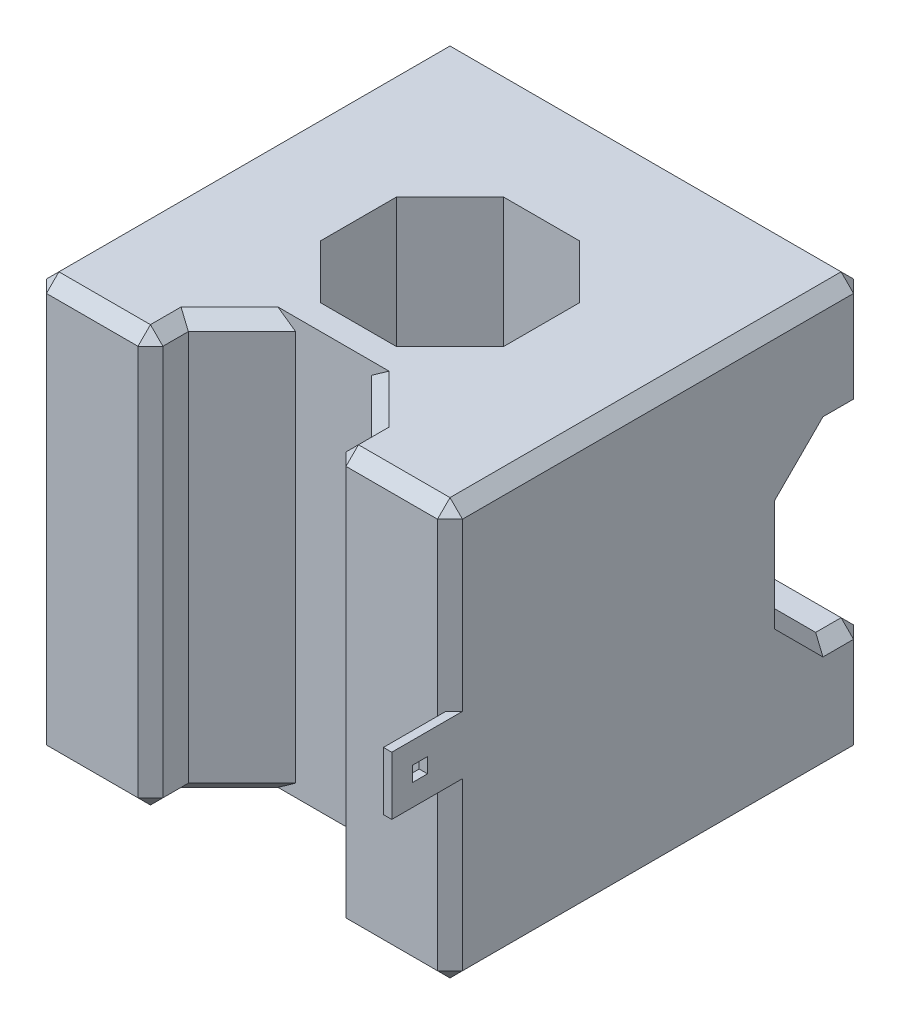
from build123d import *

# Parameters (mm, degrees)
SKETCH1_W                = 50
SKETCH1_H                = 50
BOSS_EXTRUDE1_DEPTH      = 50
CUT_EXTRUDE2_DEPTH       = 87.602540378
CUT_EXTRUDE3_DEPTH       = 87.602540378
CHAMFER1_SIZE            = 1.5
BOSS_EXTRUDE2_DEPTH      = 7
BOSS_EXTRUDE2_DEPTH_BACK = 10
SKETCH5_W                = 1
SKETCH5_H                = 7
SKETCH6_W                = 1.8
SKETCH6_H                = 1.8
CUT_EXTRUDE4_DEPTH       = 7


with BuildPart() as part:
    # Sketch1 → Boss-Extrude1 (new body)
    with BuildSketch(Plane.XY):
        with Locations((25, 25)):
            Rectangle(SKETCH1_W, SKETCH1_H)
    extrude(amount=BOSS_EXTRUDE1_DEPTH)

    # Sketch3 → Cut-Extrude2 (cut, through all)
    with BuildSketch(Plane.XZ):
        Polygon((29.556349186, 36), (20.443650814, 36), (14, 29.556349186), (14, 20.443650814), (20.443650814, 14), (29.556349186, 14), (36, 20.443650814), (36, 29.556349186), align=None)
        Polygon((29.556349186, 39), (36, 45.443650814), (36, 54.556349186), (29.556349186, 61), (20.443650814, 61), (14, 54.556349186), (14, 45.443650814), (20.443650814, 39), align=None)
    extrude(amount=-CUT_EXTRUDE2_DEPTH, mode=Mode.SUBTRACT)

    # Sketch4 → Cut-Extrude3 (cut, through all)
    with BuildSketch(Plane.ZY):
        Polygon((4.556349186, 14), (11, 20.443650814), (11, 29.556349186), (4.556349186, 36), (-4.556349186, 36), (-11, 29.556349186), (-11, 20.443650814), (-4.556349186, 14), align=None)
    extrude(amount=-CUT_EXTRUDE3_DEPTH, mode=Mode.SUBTRACT)

    # Chamfer1
    chamfer1_edges = [part.edges().sort_by_distance(p)[0] for p in [
        (50, 25, 50),
        (43, 50, 50),
        (43, 0, 50),
        (7, 50, 50),
        (36, 25, 50),
        (14, 25, 50),
        (0, 25, 50),
        (14, 50, 47.721825407),
        (36, 50, 47.721825407),
        (25, 50, 0),
        (36, 0, 47.721825407),
        (14, 0, 47.721825407),
        (17.221825407, 0, 42.221825407),
        (32.778174593, 0, 42.221825407),
        (17.221825407, 50, 42.221825407),
        (50, 7, 0),
        (32.778174593, 50, 42.221825407),
        (25, 0, 0),
        (0, 43, 0),
        (7, 0, 50),
        (0, 50, 25),
        (50, 50, 25),
        (50, 0, 25),
        (0, 0, 25),
        (0, 7, 0),
        (50, 43, 0),
        (25, 36, 0),
        (25, 14, 0),
        (50, 14, 2.278174593),
        (50, 36, 2.278174593),
        (50, 32.778174593, 7.778174593),
        (50, 17.221825407, 7.778174593),
        (0, 14, 2.278174593),
        (0, 17.221825407, 7.778174593),
        (0, 32.778174593, 7.778174593),
        (0, 36, 2.278174593),
    ]]
    chamfer(chamfer1_edges, length=CHAMFER1_SIZE)

    # Sketch5 → Boss-Extrude2 (add, two sides: drawn at the far end of the back side and taken through both)
    with BuildSketch(Plane.XY.offset(50).offset(-BOSS_EXTRUDE2_DEPTH_BACK)):
        with Locations((49.5, 25)):
            Rectangle(SKETCH5_W, SKETCH5_H)
    extrude(amount=BOSS_EXTRUDE2_DEPTH + BOSS_EXTRUDE2_DEPTH_BACK)

    # Sketch6 → Cut-Extrude4 (cut)
    with BuildSketch(Plane(origin=(50, 0, 0), x_dir=(0, 0, -1), z_dir=(1, 0, 0))):
        with Locations((-53.6, 25)):
            Rectangle(SKETCH6_W, SKETCH6_H)
    extrude(amount=-CUT_EXTRUDE4_DEPTH, mode=Mode.SUBTRACT)


solid = part.part
